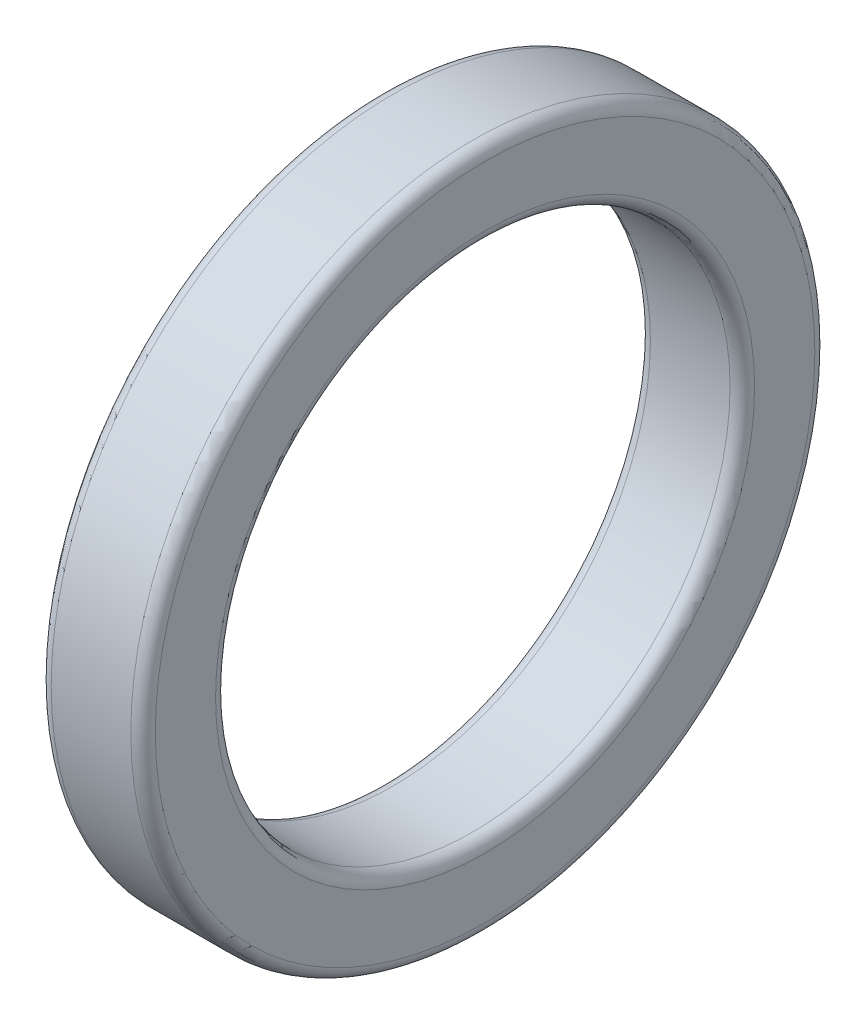
from build123d import *

# Parameters (mm, degrees)
SKETCH3_R           = 279.2
SKETCH3_R_2         = 210
BOSS_EXTRUDE1_DEPTH = 42.5
FILLET1_R           = 10


with BuildPart() as part:
    # Sketch3 → Boss-Extrude1 (new, symmetric)
    with BuildSketch(Plane(origin=(0, 0, 0), x_dir=(0, 0, -1), z_dir=(1, 0, 0))):
        Circle(SKETCH3_R)
        Circle(SKETCH3_R_2, mode=Mode.SUBTRACT)
    extrude(amount=BOSS_EXTRUDE1_DEPTH, both=True)

    # Fillet1
    fillet1_edges = [part.edges().sort_by_distance(p)[0] for p in [
        (-42.5, 0, 279.2),
        (42.5, 0, 279.2),
        (-42.5, 0, 210),
        (42.5, 0, 210),
    ]]
    fillet(fillet1_edges, radius=FILLET1_R)


solid = part.part
